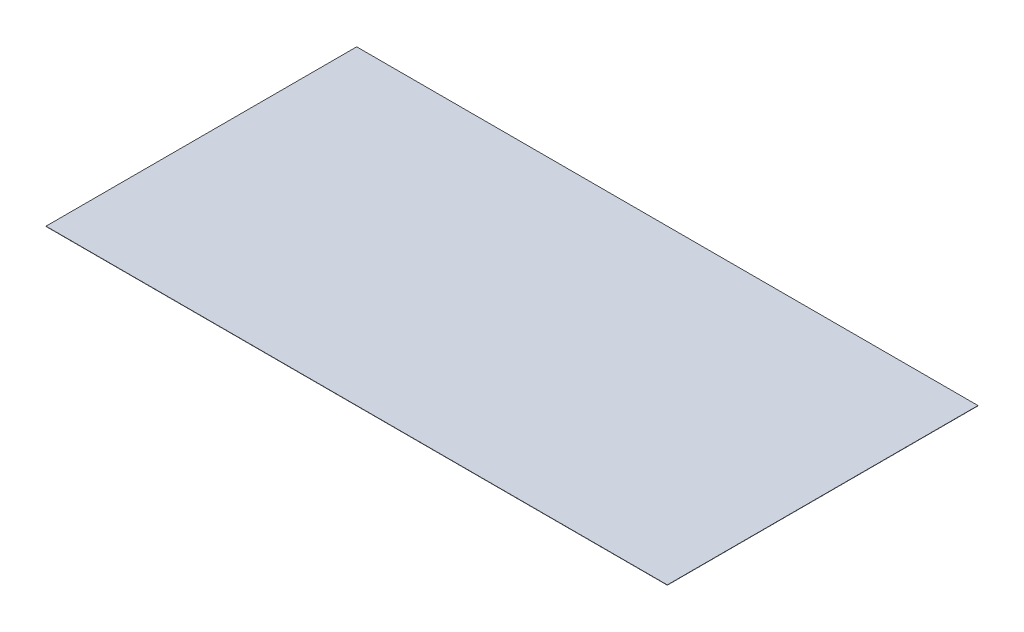
from build123d import *

# Parameters (mm, degrees)
SKETCH1_W           = 2438.4
SKETCH1_H           = 1219.2
BOSS_EXTRUDE1_DEPTH = 1


with BuildPart() as part:
    # Sketch1 → Boss-Extrude1 (new body)
    with BuildSketch(Plane(origin=(0, 0, 0), x_dir=(1, 0, 0), z_dir=(0, 1, 0))):
        with Locations((1219.2, 609.6)):
            Rectangle(SKETCH1_W, SKETCH1_H)
    extrude(amount=BOSS_EXTRUDE1_DEPTH)


solid = part.part
